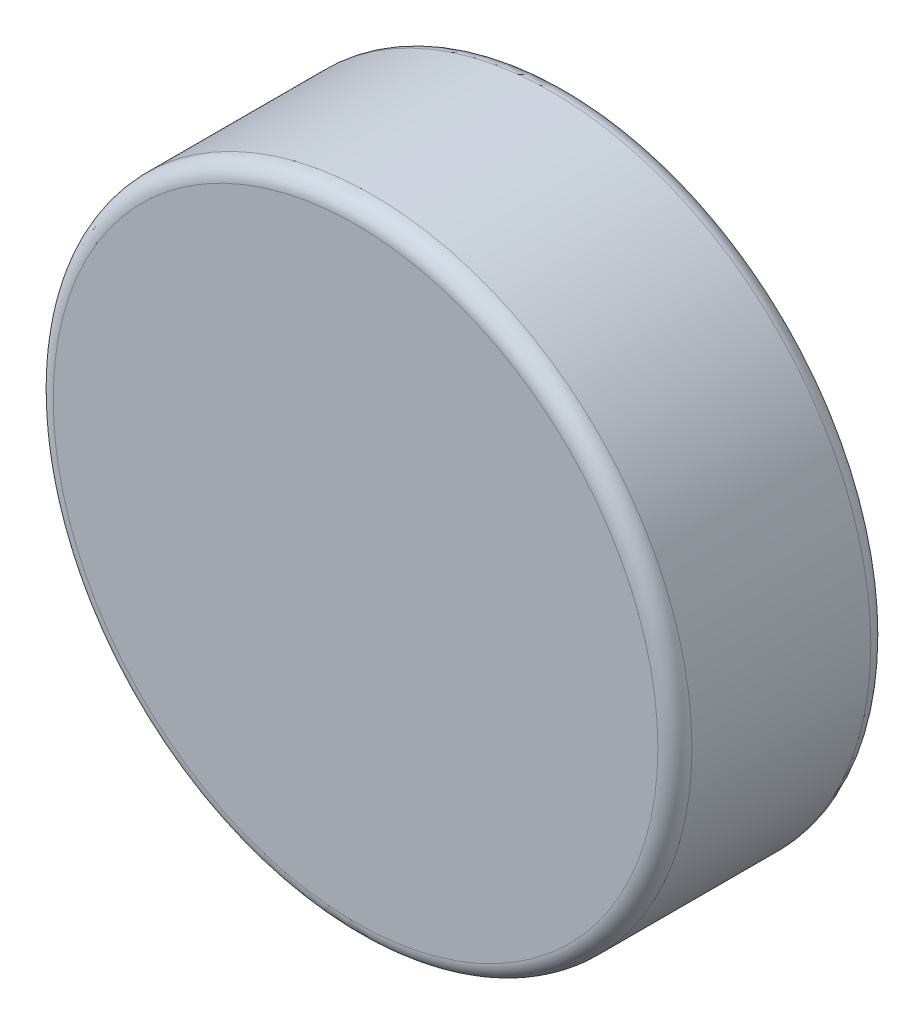
from build123d import *

# Parameters (mm, degrees)
BOSS_EXTRUDE1_DEPTH      = 0.79375
BOSS_EXTRUDE1_DEPTH_BACK = 0.79375
SKETCH3_R                = 2.38125
FILLET1_R                = 0.127


with BuildPart() as part:
    # Sketch3 → Boss-Extrude1 (new, two sides: drawn at the far end of the back side and taken through both)
    with BuildSketch(Plane.XY.offset(-BOSS_EXTRUDE1_DEPTH_BACK)):
        with Locations(Location((0, 0, 0), (0, 0, 180))):
            Circle(SKETCH3_R)
    extrude(amount=BOSS_EXTRUDE1_DEPTH + BOSS_EXTRUDE1_DEPTH_BACK)

    # Fillet1
    fillet1_edges = [part.edges().sort_by_distance(p)[0] for p in [
        (2.38125, 0, -0.79375),
        (2.38125, 0, 0.79375),
    ]]
    fillet(fillet1_edges, radius=FILLET1_R)


solid = part.part
